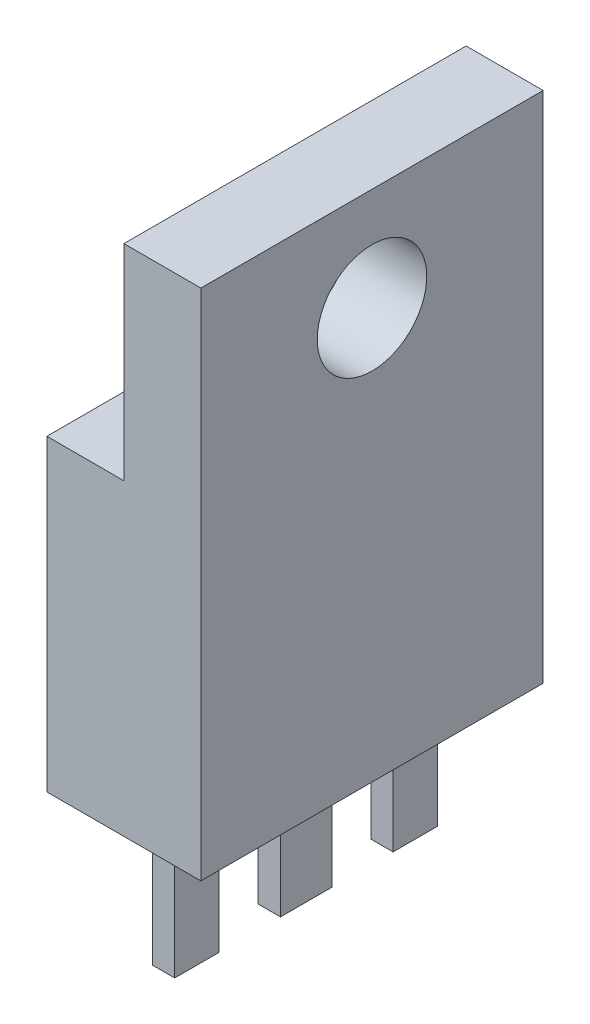
from build123d import *

# Parameters (mm, degrees)
SKETCH_1_W          = 4.5
SKETCH_1_H          = 10
EXTRUDE_1_DEPTH     = 9
SKETCH_2_W          = 2.25
SKETCH_2_H          = 10
EXTRUDE_2_DEPTH     = 6
SKETCH_3_R          = 1.6
CUT_EXTRUDE_1_DEPTH = 19.167622299
SKETCH_4_W          = 0.65
SKETCH_4_H          = 1.3
SKETCH_4_H_2        = 1.5
EXTRUDE_3_DEPTH     = 4


with BuildPart() as part:
    # Эскиз1 → Бобышка-Вытянуть1 (new body)
    with BuildSketch(Plane(origin=(0, 0, 0), x_dir=(1, 0, 0), z_dir=(0, 1, 0))):
        with Locations((2.25, 5)):
            Rectangle(SKETCH_1_W, SKETCH_1_H)
    extrude(amount=EXTRUDE_1_DEPTH)

    # Эскиз2 → Бобышка-Вытянуть2 (add)
    with BuildSketch(Plane(origin=(0, 9, 0), x_dir=(1, 0, 0), z_dir=(0, 1, 0))):
        with Locations((3.375, 5)):
            Rectangle(SKETCH_2_W, SKETCH_2_H)
    extrude(amount=EXTRUDE_2_DEPTH)

    # Эскиз3 → Вырез-Вытянуть1 (cut, through all)
    with BuildSketch(Plane.ZY.offset(-2.25)):
        with Locations((-5, 12)):
            Circle(SKETCH_3_R)
    extrude(amount=-CUT_EXTRUDE_1_DEPTH, mode=Mode.SUBTRACT)

    # Эскиз4 → Бобышка-Вытянуть3 (add)
    with BuildSketch(Plane.XZ):
        with Locations((2.25, -1.81)):
            Rectangle(SKETCH_4_W, SKETCH_4_H)
        with Locations((2.25, -5)):
            Rectangle(SKETCH_4_W, SKETCH_4_H_2)
        with Locations((2.25, -8.19)):
            Rectangle(SKETCH_4_W, SKETCH_4_H)
    extrude(amount=EXTRUDE_3_DEPTH)


solid = part.part
